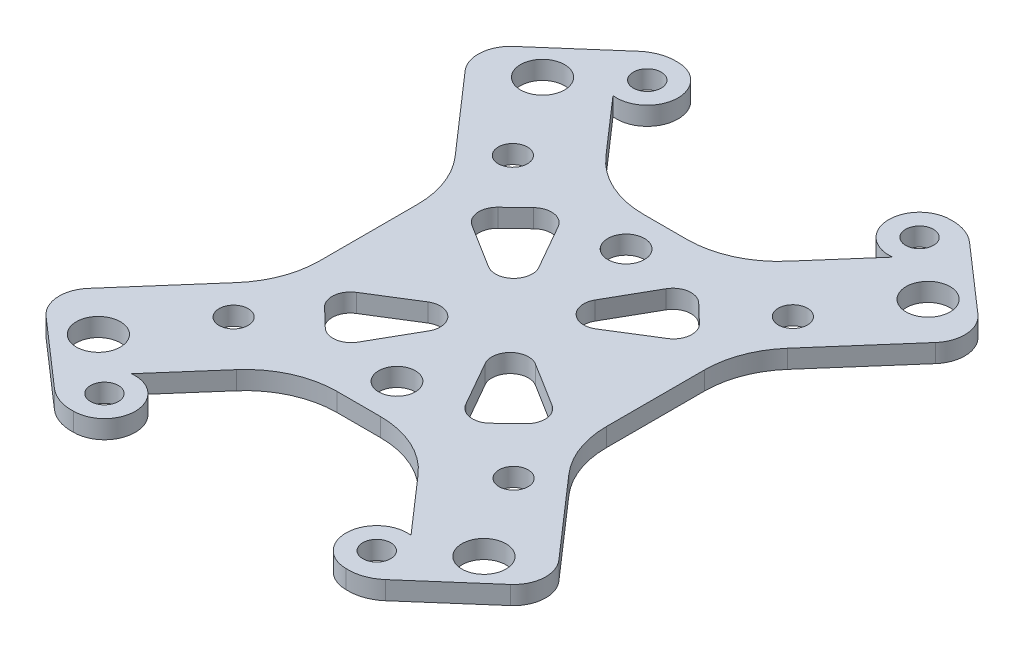
from build123d import *

# Parameters (mm, degrees)
CROQUIS2_R              = 1.52
CROQUIS2_R_2            = 2.4
CROQUIS2_R_3            = 1.59
CROQUIS2_R_4            = 2
SALIENTE_EXTRUIR1_DEPTH = 2


with BuildPart() as part:
    # Croquis2 → Saliente-Extruir1 (new body)
    with BuildSketch(Plane(origin=(0, 0, 0), x_dir=(1, 0, 0), z_dir=(0, 1, 0))):
        with BuildLine():
            ThreePointArc((-15.6443026, -5.332651407), (-16.282242792, -8.847169319), (-18.114669831, -11.913276785))
            Line((-18.114669831, -11.913276785), (-25.665833323, -20.55341124))
            ThreePointArc((-25.665833323, -20.55341124), (-26.522572581, -23.091497469), (-25.333680736, -25.492001591))
            Line((-25.333680736, -25.492001591), (-21.870049663, -28.519089265))
            Line((-21.870049663, -28.519089265), (-18.053864835, -31.854296107))
            ThreePointArc((-18.053864835, -31.854296107), (-16.559946136, -32.720000224), (-14.85, -32.95941808))
            ThreePointArc((-14.85, -32.95941808), (-11.500177955, -29.398955686), (-15.258060002, -26.272212538))
            Line((-15.258060002, -26.272212538), (-9.898337732, -20.139552173))
            ThreePointArc((-9.898337732, -20.139552173), (-6.503541491, -17.615062127), (-2.368704963, -16.720177551))
            Line((-2.368704963, -16.720177551), (2.368704963, -16.720177551))
            ThreePointArc((2.368704963, -16.720177551), (6.503541491, -17.615062127), (9.898337732, -20.139552173))
            Line((9.898337732, -20.139552173), (15.258060002, -26.272212538))
            ThreePointArc((15.258060002, -26.272212538), (11.500177955, -29.398955686), (14.85, -32.95941808))
            ThreePointArc((14.85, -32.95941808), (16.559946136, -32.720000224), (18.053864835, -31.854296107))
            Line((18.053864835, -31.854296107), (21.870049663, -28.519089265))
            Line((21.870049663, -28.519089265), (25.333680736, -25.492001591))
            ThreePointArc((25.333680736, -25.492001591), (26.522572581, -23.091497469), (25.665833323, -20.55341124))
            Line((25.665833323, -20.55341124), (18.114669831, -11.913276785))
            ThreePointArc((18.114669831, -11.913276785), (16.282242792, -8.847169319), (15.6443026, -5.332651407))
            Line((15.6443026, -5.332651407), (15.6443026, 5.332651407))
            ThreePointArc((15.6443026, 5.332651407), (16.282242792, 8.847169319), (18.114669831, 11.913276785))
            Line((18.114669831, 11.913276785), (25.665833323, 20.55341124))
            ThreePointArc((25.665833323, 20.55341124), (26.522572581, 23.091497469), (25.333680736, 25.492001591))
            Line((25.333680736, 25.492001591), (21.870049663, 28.519089265))
            Line((21.870049663, 28.519089265), (18.053864835, 31.854296107))
            ThreePointArc((18.053864835, 31.854296107), (16.559946136, 32.720000224), (14.85, 32.95941808))
            ThreePointArc((14.85, 32.95941808), (11.500177955, 29.398955686), (15.258060002, 26.272212538))
            Line((15.258060002, 26.272212538), (9.898337732, 20.139552173))
            ThreePointArc((9.898337732, 20.139552173), (6.503541491, 17.615062127), (2.368704963, 16.720177551))
            Line((2.368704963, 16.720177551), (-2.368704963, 16.720177551))
            ThreePointArc((-2.368704963, 16.720177551), (-6.503541491, 17.615062127), (-9.898337732, 20.139552173))
            Line((-9.898337732, 20.139552173), (-15.258060002, 26.272212538))
            ThreePointArc((-15.258060002, 26.272212538), (-11.500177955, 29.398955686), (-14.85, 32.95941808))
            ThreePointArc((-14.85, 32.95941808), (-16.559946136, 32.720000224), (-18.053864835, 31.854296107))
            Line((-18.053864835, 31.854296107), (-21.870049663, 28.519089265))
            Line((-21.870049663, 28.519089265), (-25.333680736, 25.492001591))
            ThreePointArc((-25.333680736, 25.492001591), (-26.522572581, 23.091497469), (-25.665833323, 20.55341124))
            Line((-25.665833323, 20.55341124), (-18.114669831, 11.913276785))
            ThreePointArc((-18.114669831, 11.913276785), (-16.282242792, 8.847169319), (-15.6443026, 5.332651407))
            Line((-15.6443026, 5.332651407), (-15.6443026, -5.332651407))
        make_face()
        with Locations(Location((-14.85, -29.603365193, 0), (0, 0, 270))):
            Circle(CROQUIS2_R, mode=Mode.SUBTRACT)
        with Locations(Location((-20.768636021, -24.348641057, 0), (0, 0, 270))):
            Circle(CROQUIS2_R_2, mode=Mode.SUBTRACT)
        with Locations(Location((-15.030603638, -15.334854811, 0), (0, 0, 270))):
            Circle(CROQUIS2_R_3, mode=Mode.SUBTRACT)
        with Locations(Location((-0.05, -12.497128708, 0), (0, 0, 270))):
            Circle(CROQUIS2_R_4, mode=Mode.SUBTRACT)
        with BuildLine():
            Line((-3.074423593, -5.999581964), (-5.873559772, -10.915994174))
            ThreePointArc((-5.873559772, -10.915994174), (-7.324662306, -11.905756202), (-8.997091839, -11.368814033))
            Line((-8.997091839, -11.368814033), (-10.997834751, -9.446969084))
            ThreePointArc((-10.997834751, -9.446969084), (-11.601593103, -7.79748332), (-10.670982222, -6.30775488))
            Line((-10.670982222, -6.30775488), (-5.87110313, -3.313187619))
            ThreePointArc((-5.87110313, -3.313187619), (-3.426979279, -3.567667883), (-3.074423593, -5.999581964))
        make_face(mode=Mode.SUBTRACT)
        with Locations(Location((14.85, -29.603365193, 0), (0, 0, 270))):
            Circle(CROQUIS2_R, mode=Mode.SUBTRACT)
        with Locations(Location((21.231326929, -24.292854014, 0), (0, 0, 270))):
            Circle(CROQUIS2_R_2, mode=Mode.SUBTRACT)
        with BuildLine():
            Line((10.997834751, -9.446969084), (8.997091839, -11.368814033))
            ThreePointArc((8.997091839, -11.368814033), (7.324662306, -11.905756202), (5.873559772, -10.915994174))
            Line((5.873559772, -10.915994174), (3.074423593, -5.999581964))
            ThreePointArc((3.074423593, -5.999581964), (3.426979279, -3.567667883), (5.87110313, -3.313187619))
            Line((5.87110313, -3.313187619), (10.670982222, -6.30775488))
            ThreePointArc((10.670982222, -6.30775488), (11.601593103, -7.79748332), (10.997834751, -9.446969084))
        make_face(mode=Mode.SUBTRACT)
        with Locations(Location((15.469369457, -15.294342791, 0), (0, 0, 270))):
            Circle(CROQUIS2_R_3, mode=Mode.SUBTRACT)
        with Locations(Location((-15.071115657, 15.165118284, 0), (0, 0, 270))):
            Circle(CROQUIS2_R_3, mode=Mode.SUBTRACT)
        with BuildLine():
            Line((-10.997834751, 9.446969084), (-8.997091839, 11.368814033))
            ThreePointArc((-8.997091839, 11.368814033), (-7.324662306, 11.905756202), (-5.873559772, 10.915994174))
            Line((-5.873559772, 10.915994174), (-3.074423593, 5.999581964))
            ThreePointArc((-3.074423593, 5.999581964), (-3.426979279, 3.567667883), (-5.87110313, 3.313187619))
            Line((-5.87110313, 3.313187619), (-10.670982222, 6.30775488))
            ThreePointArc((-10.670982222, 6.30775488), (-11.601593103, 7.79748332), (-10.997834751, 9.446969084))
        make_face(mode=Mode.SUBTRACT)
        with Locations(Location((-0.05, 12.497128708, 0), (0, 0, 270))):
            Circle(CROQUIS2_R_4, mode=Mode.SUBTRACT)
        with Locations(Location((-20.833073129, 24.163629506, 0), (0, 0, 270))):
            Circle(CROQUIS2_R_2, mode=Mode.SUBTRACT)
        with Locations(Location((-14.85, 29.603365193, 0), (0, 0, 270))):
            Circle(CROQUIS2_R, mode=Mode.SUBTRACT)
        with BuildLine():
            Line((3.074423593, 5.999581964), (5.873559772, 10.915994174))
            ThreePointArc((5.873559772, 10.915994174), (7.324662306, 11.905756202), (8.997091839, 11.368814033))
            Line((8.997091839, 11.368814033), (10.997834751, 9.446969084))
            ThreePointArc((10.997834751, 9.446969084), (11.601593103, 7.79748332), (10.670982222, 6.30775488))
            Line((10.670982222, 6.30775488), (5.87110313, 3.313187619))
            ThreePointArc((5.87110313, 3.313187619), (3.426979279, 3.567667883), (3.074423593, 5.999581964))
        make_face(mode=Mode.SUBTRACT)
        with Locations(Location((15.428857437, 15.205630304, 0), (0, 0, 270))):
            Circle(CROQUIS2_R_3, mode=Mode.SUBTRACT)
        with Locations(Location((21.166889821, 24.21941655, 0), (0, 0, 270))):
            Circle(CROQUIS2_R_2, mode=Mode.SUBTRACT)
        with Locations(Location((14.85, 29.603365193, 0), (0, 0, 270))):
            Circle(CROQUIS2_R, mode=Mode.SUBTRACT)
    extrude(amount=SALIENTE_EXTRUIR1_DEPTH)


solid = part.part
